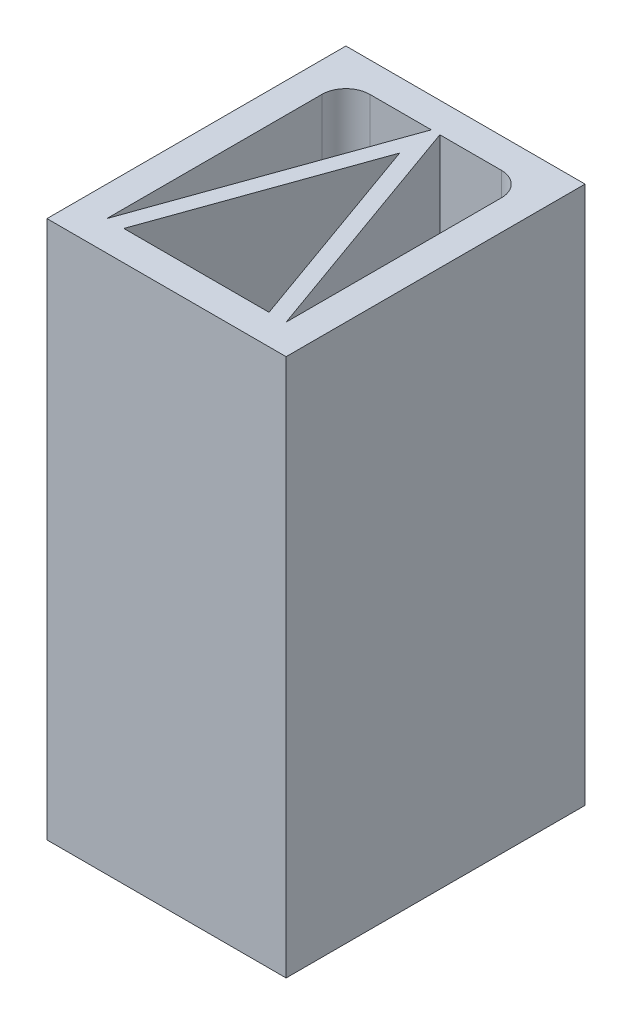
from build123d import *

# Parameters (mm, degrees)
SKETCH1_W           = 20
SKETCH1_H           = 25
SKETCH1_W_2         = 15
SKETCH1_H_2         = 20
BOSS_EXTRUDE1_DEPTH = 45
BOSS_EXTRUDE4_DEPTH = 45
FILLET2_R           = 2


with BuildPart() as part:
    # Sketch1 → Boss-Extrude1 (new body)
    with BuildSketch(Plane(origin=(0, 0, 0), x_dir=(1, 0, 0), z_dir=(0, 1, 0))):
        with Locations((10, 12.5)):
            Rectangle(SKETCH1_W, SKETCH1_H)
        with Locations((10, 12.5)):
            Rectangle(SKETCH1_W_2, SKETCH1_H_2, mode=Mode.SUBTRACT)
    extrude(amount=BOSS_EXTRUDE1_DEPTH)

    # Sketch3 → Boss-Extrude4 (add, through all)
    with BuildSketch(Plane.XZ):
        Polygon((17.5, -2.5), (10, -23.5), (2.5, -2.5), (3.928571429, -2.5), (10, -19.5), (16.071428571, -2.5), align=None)
    extrude(amount=-BOSS_EXTRUDE4_DEPTH)

    # Fillet2
    fillet2_edges = [part.edges().sort_by_distance(p)[0] for p in [
        (2.5, 22.5, -22.5),
        (17.5, 22.5, -22.5),
    ]]
    fillet(fillet2_edges, radius=FILLET2_R)


solid = part.part
